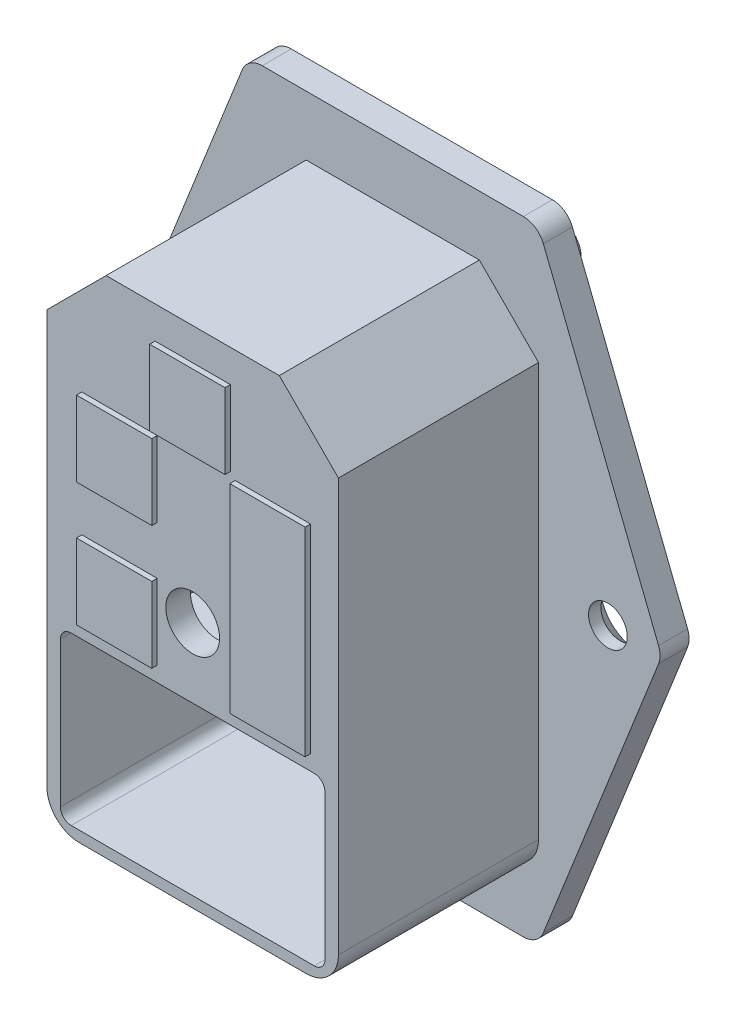
from build123d import *

# Parameters (mm, degrees)
SKETCH1_W                    = 27
SKETCH1_H                    = 58
BOSS_EXTRUDE1_DEPTH          = 2.7
FILLET1_R                    = 2
BOSS_EXTRUDE2_DEPTH          = 0.7
SKETCH5_W                    = 27.1
SKETCH5_H                    = 46.9
BOSS_EXTRUDE3_DEPTH          = 18.6
FILLET2_R                    = 3
CHAMFER1_SIZE                = 5.5
CUT_EXTRUDE1_DEPTH           = 15.8
SKETCH7_W                    = 9.25
SKETCH7_H                    = 2.45
SKETCH7_W_2                  = 24.6
SKETCH7_H_2                  = 8.55
CUT_EXTRUDE2_DEPTH           = 19.7
SKETCH8_R                    = 2.5
CUT_EXTRUDE3_DEPTH           = 43.971353827
SKETCH9_W                    = 20
SKETCH9_H                    = 13
CUT_EXTRUDE4_DEPTH           = 45.073203307
CUT_EXTRUDE5_DEPTH           = 1.9
SKETCH11_W                   = 7
SKETCH11_H                   = 7
SKETCH11_H_2                 = 18.5
BOSS_EXTRUDE4_DEPTH          = 0.5
SKETCH12_W                   = 5.3
SKETCH12_H                   = 1.45
BOSS_EXTRUDE5_DEPTH          = 9.9
SKETCH12_3_W                 = 2
SKETCH12_3_H                 = 4
BOSS_EXTRUDE6_DEPTH          = 14.6
SKETCH12_4_W                 = 2
SKETCH12_4_H                 = 4
BOSS_EXTRUDE7_DEPTH          = 17.5
CSK_FOR_M3_SFHCS1_AT_2_COUNT = 2
CSK_FOR_M3_SFHCS1_AT_2_PITCH = 40


with BuildPart() as part:
    # Sketch1 → Boss-Extrude1 (new body)
    with BuildSketch(Plane.XY):
        Polygon((-13.5, 29), (-25, 0), (-13.5, -29), align=None)
        Rectangle(SKETCH1_W, SKETCH1_H)
        Polygon((13.5, 29), (25, 0), (13.5, -29), align=None)
    extrude(amount=BOSS_EXTRUDE1_DEPTH)

    # Fillet1
    fillet1_edges = [part.edges().sort_by_distance(p)[0] for p in [
        (-13.5, 29, 1.35),
        (13.5, 29, 1.35),
        (25, 0, 1.35),
        (13.5, -29, 1.35),
        (-13.5, -29, 1.35),
        (-25, 0, 1.35),
    ]]
    fillet(fillet1_edges, radius=FILLET1_R)

    # Sketch2 → Boss-Extrude2 (add)
    with BuildSketch(Plane(origin=(0, 0, 0), x_dir=(-1, 0, 0), z_dir=(0, 0, -1))):
        with BuildLine():
            Line((-12.1, -27.1), (12.1, -27.1))
            ThreePointArc((12.1, -27.1), (13.514213562, -26.514213562), (14.1, -25.1))
            Line((14.1, -25.1), (14.1, 25.1))
            ThreePointArc((14.1, 25.1), (13.514213562, 26.514213562), (12.1, 27.1))
            Line((12.1, 27.1), (-12.1, 27.1))
            ThreePointArc((-12.1, 27.1), (-13.514213562, 26.514213562), (-14.1, 25.1))
            Line((-14.1, 25.1), (-14.1, -25.1))
            ThreePointArc((-14.1, -25.1), (-13.514213562, -26.514213562), (-12.1, -27.1))
        make_face()
    extrude(amount=BOSS_EXTRUDE2_DEPTH)

    # Sketch5 → Boss-Extrude3 (add)
    with BuildSketch(Plane.XY.offset(2.7)):
        Rectangle(SKETCH5_W, SKETCH5_H)
    extrude(amount=BOSS_EXTRUDE3_DEPTH)

    # Fillet2
    fillet2_edges = [part.edges().sort_by_distance(p)[0] for p in [
        (13.55, -23.45, 12),
        (-13.55, -23.45, 12),
    ]]
    fillet(fillet2_edges, radius=FILLET2_R)

    # Chamfer1
    chamfer1_edges = [part.edges().sort_by_distance(p)[0] for p in [
        (13.55, 23.45, 12),
        (-13.55, 23.45, 12),
    ]]
    chamfer(chamfer1_edges, length=CHAMFER1_SIZE)

    # Sketch6 → Cut-Extrude1 (cut)
    with BuildSketch(Plane.XY.offset(21.3)):
        with BuildLine():
            Line((-11.3, -22.45), (11.3, -22.45))
            ThreePointArc((11.3, -22.45), (12.007106781, -22.157106781), (12.3, -21.45))
            Line((12.3, -21.45), (12.3, -7.95))
            ThreePointArc((12.3, -7.95), (12.007106781, -7.242893219), (11.3, -6.95))
            Line((11.3, -6.95), (-11.3, -6.95))
            ThreePointArc((-11.3, -6.95), (-12.007106781, -7.242893219), (-12.3, -7.95))
            Line((-12.3, -7.95), (-12.3, -21.45))
            ThreePointArc((-12.3, -21.45), (-12.007106781, -22.157106781), (-11.3, -22.45))
        make_face()
    extrude(amount=-CUT_EXTRUDE1_DEPTH, mode=Mode.SUBTRACT)

    # Sketch7 → Cut-Extrude2 (cut)
    with BuildSketch(Plane(origin=(0, 0, -0.7), x_dir=(-1, 0, 0), z_dir=(0, 0, -1))):
        Polygon((-12.45, 6.25), (12.45, 6.25), (12.45, 17.55), (7.45, 22.55), (-7.45, 22.55), (-12.45, 17.55), align=None)
        with Locations((0, 5.025)):
            Rectangle(SKETCH7_W, SKETCH7_H)
        with Locations((0, -0.475)):
            Rectangle(SKETCH7_W_2, SKETCH7_H_2)
    extrude(amount=-CUT_EXTRUDE2_DEPTH, mode=Mode.SUBTRACT)

    # Sketch8 → Cut-Extrude3 (cut, through all)
    with BuildSketch(Plane(origin=(0, 0, 19), x_dir=(-1, 0, 0), z_dir=(0, 0, -1))):
        with Locations((0, -0.475)):
            Circle(SKETCH8_R)
    extrude(amount=-CUT_EXTRUDE3_DEPTH, mode=Mode.SUBTRACT)

    # Sketch9 → Cut-Extrude4 (cut, through all)
    with BuildSketch(Plane(origin=(0, 0, -0.7), x_dir=(-1, 0, 0), z_dir=(0, 0, -1))):
        with Locations((0, -14.7)):
            Rectangle(SKETCH9_W, SKETCH9_H)
    extrude(amount=-CUT_EXTRUDE4_DEPTH, mode=Mode.SUBTRACT)

    # Sketch10 → Cut-Extrude5 (cut)
    with BuildSketch(Plane(origin=(0, 0, -0.7), x_dir=(-1, 0, 0), z_dir=(0, 0, -1))):
        with BuildLine():
            Line((-9.75, -22.45), (9.75, -22.45))
            ThreePointArc((9.75, -22.45), (10.457106781, -22.157106781), (10.75, -21.45))
            Line((10.75, -21.45), (10.75, -7.95))
            ThreePointArc((10.75, -7.95), (10.457106781, -7.242893219), (9.75, -6.95))
            Line((9.75, -6.95), (-9.75, -6.95))
            ThreePointArc((-9.75, -6.95), (-10.457106781, -7.242893219), (-10.75, -7.95))
            Line((-10.75, -7.95), (-10.75, -21.45))
            ThreePointArc((-10.75, -21.45), (-10.457106781, -22.157106781), (-9.75, -22.45))
        make_face()
    extrude(amount=-CUT_EXTRUDE5_DEPTH, mode=Mode.SUBTRACT)

    # Sketch11 → Boss-Extrude4 (add)
    with BuildSketch(Plane.XY.offset(21.3)):
        with Locations((0, 16.95)):
            Rectangle(SKETCH11_W, SKETCH11_H)
        with Locations((7.45, 3.7)):
            Rectangle(SKETCH11_W, SKETCH11_H_2)
        with Locations((-6.8, 9.45)):
            Rectangle(SKETCH11_W, SKETCH11_H)
        with Locations((-6.8, -2.05)):
            Rectangle(SKETCH11_W, SKETCH11_H)
    extrude(amount=BOSS_EXTRUDE4_DEPTH)

    # Sketch12 → Boss-Extrude5 (add)
    with BuildSketch(Plane(origin=(0, 0, 19), x_dir=(-1, 0, 0), z_dir=(0, 0, -1))):
        with Locations((-8.25, 1.95)):
            Rectangle(SKETCH12_W, SKETCH12_H)
        with Locations((-8.25, -2.9)):
            Rectangle(SKETCH12_W, SKETCH12_H)
        with Locations((8.25, 1.95)):
            Rectangle(SKETCH12_W, SKETCH12_H)
        with Locations((8.25, -2.9)):
            Rectangle(SKETCH12_W, SKETCH12_H)
    extrude(amount=BOSS_EXTRUDE5_DEPTH)

    # Sketch12<3> → Boss-Extrude6 (add)
    with BuildSketch(Plane(origin=(0, 0, 19), x_dir=(-1, 0, 0), z_dir=(0, 0, -1))):
        with Locations((-7, 12.4)):
            Rectangle(SKETCH12_3_W, SKETCH12_3_H)
        with Locations((7, 12.4)):
            Rectangle(SKETCH12_3_W, SKETCH12_3_H)
    extrude(amount=BOSS_EXTRUDE6_DEPTH)

    # Sketch12<4> → Boss-Extrude7 (add)
    with BuildSketch(Plane(origin=(0, 0, 19), x_dir=(-1, 0, 0), z_dir=(0, 0, -1))):
        with Locations((0, 16.15)):
            Rectangle(SKETCH12_4_W, SKETCH12_4_H)
    extrude(amount=BOSS_EXTRUDE7_DEPTH)

    # Sketch16 → CSK for M3 SFHCS1 (revolve, cut)
    with BuildSketch(Plane.YZ.offset(20)):
        Polygon((0, 0), (0, 2.7), (1.8, 2.7), (1.8, 1.56), (3.36, 0), align=None)
    csk_for_m3_sfhcs1 = revolve(axis=Axis((20, 0, -6.35), (0, 0, 1)), mode=Mode.SUBTRACT)

    # CSK for M3 SFHCS1 at 2: CSK for M3 SFHCS1 ×2
    with Locations(*[(-i * CSK_FOR_M3_SFHCS1_AT_2_PITCH, 0, 0) for i in range(1, CSK_FOR_M3_SFHCS1_AT_2_COUNT)]):
        add(csk_for_m3_sfhcs1, mode=Mode.SUBTRACT)


solid = part.part
